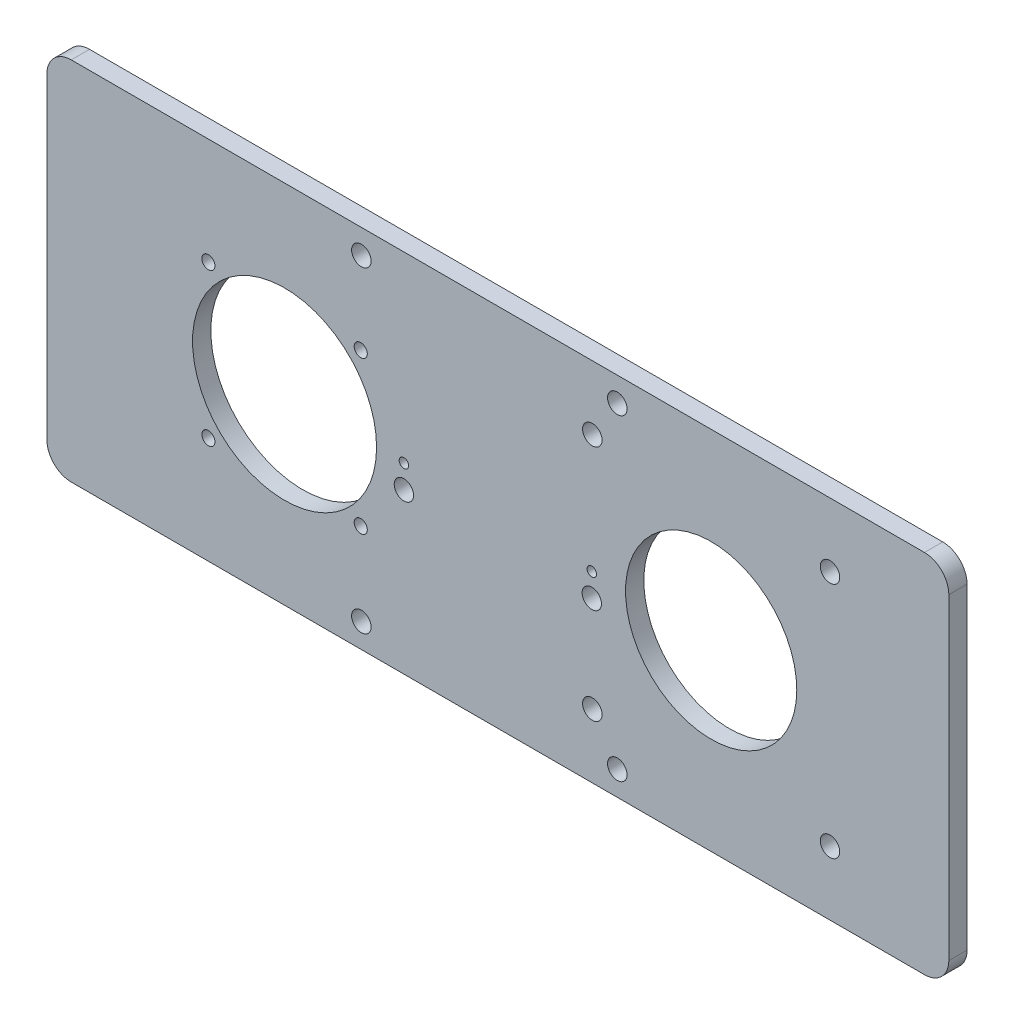
from build123d import *

# Parameters (mm, degrees)
SKETCH3_W           = 148
SKETCH3_H           = 60
SKETCH3_R           = 15.1
SKETCH3_R_2         = 14.05
BOSS_EXTRUDE2_DEPTH = 3
FILLET1_R           = 4
EVK4_HOLES_D        = 2.15
FLIR_HOLES_D        = 3.2
VN_MOUNT_HOLES_D    = 3.175
VN_REF_HOLES_D      = 1.55
PCB_MOUNT_HOLES_D   = 3.2


with BuildPart() as part:
    # Sketch3 → Boss-Extrude2 (new body)
    with BuildSketch(Plane.XY):
        Rectangle(SKETCH3_W, SKETCH3_H)
        with Locations((-35, 0)):
            Circle(SKETCH3_R, mode=Mode.SUBTRACT)
        with Locations((35, 0)):
            Circle(SKETCH3_R_2, mode=Mode.SUBTRACT)
    extrude(amount=-BOSS_EXTRUDE2_DEPTH)

    # Fillet1
    fillet1_edges = [part.edges().sort_by_distance(p)[0] for p in [
        (-74, 30, -1.5),
        (74, 30, -1.5),
        (74, -30, -1.5),
        (-74, -30, -1.5),
    ]]
    fillet(fillet1_edges, radius=FILLET1_R)

    # EVK4-Holes (through all)
    with Locations(Plane.XY):
        with Locations((-47.5, 12.5), (-22.5, 12.5), (-22.5, -12.5), (-47.5, -12.5)):
            Hole(EVK4_HOLES_D / 2)

    # FLIR-Holes (through all)
    with Locations(Plane.XY):
        with Locations((15.5, 19.5), (54.5, 19.5), (54.5, -19.5), (15.5, -19.5)):
            Hole(FLIR_HOLES_D / 2)

    # VN-Mount-Holes (through all)
    with Locations(Plane.XY):
        with Locations((-15.42, -3.81), (15.4159, -3.81)):
            Hole(VN_MOUNT_HOLES_D / 2)

    # VN-Ref-Holes (through all)
    with Locations(Plane.XY):
        with Locations((-15.42, 0), (15.4159, 0)):
            Hole(VN_REF_HOLES_D / 2)

    # PCB-Mount-Holes (through all)
    with Locations(Plane.XY):
        with Locations((-22.4, 26), (19.6, 26), (19.6, -26), (-22.4, -26)):
            Hole(PCB_MOUNT_HOLES_D / 2)


solid = part.part
